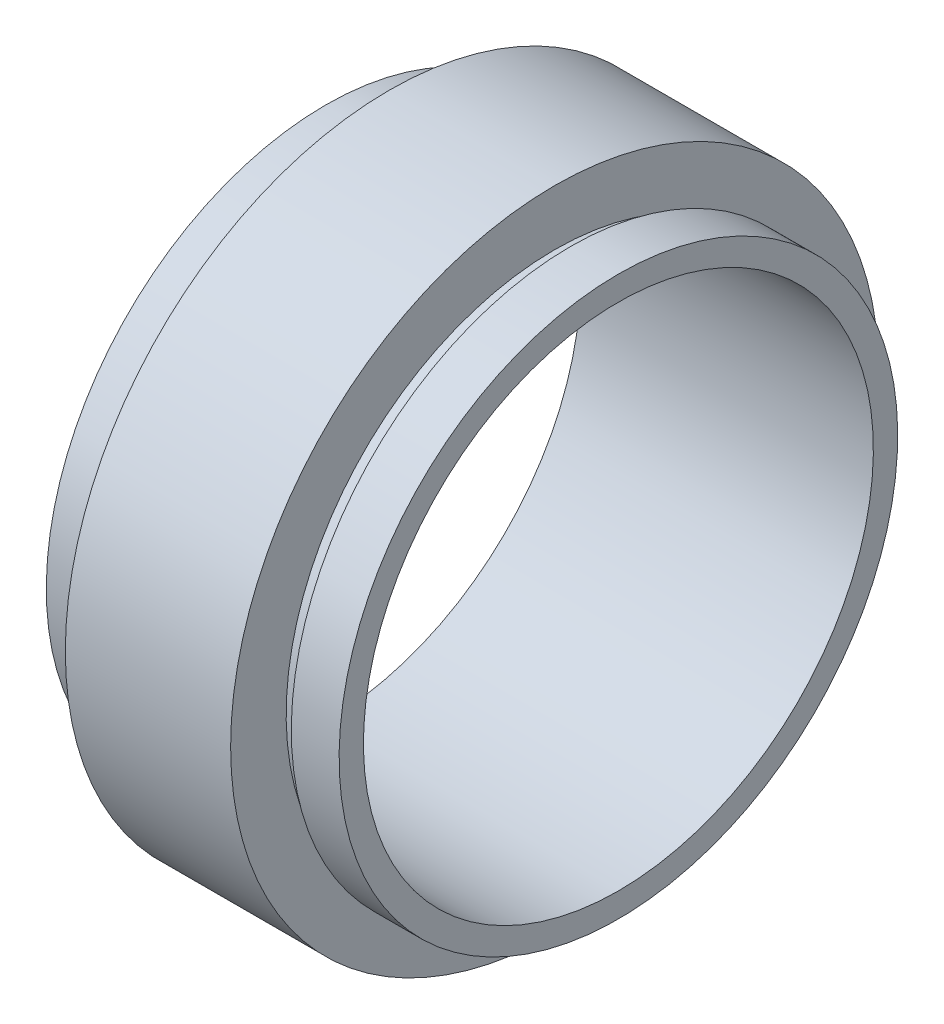
from build123d import *

# Parameters (mm, degrees)
SKETCH3_R          = 12
CUT_EXTRUDE1_DEPTH = 26.593229573


with BuildPart() as part:
    # Sketch2 → Revolve1 (revolve)
    with BuildSketch(Plane.XY):
        Polygon((6.89, 0), (-6.89, 0), (-6.89, 13.1445), (-4.64, 13.1445), (-4.64, 12.6365), (-3.89, 12.6365), (-3.89, 15.25), (3.89, 15.25), (3.89, 12.6365), (4.64, 12.6365), (4.64, 13.1445), (6.89, 13.1445), align=None)
    revolve(axis=Axis((6.89, 0, 0), (-1, 0, 0)))

    # Sketch3 → Cut-Extrude1 (cut, through all)
    with BuildSketch(Plane.ZY.offset(6.89)):
        with Locations(Location((0, 0, 0), (0, 0, 270))):
            Circle(SKETCH3_R)
    extrude(amount=-CUT_EXTRUDE1_DEPTH, mode=Mode.SUBTRACT)


solid = part.part
